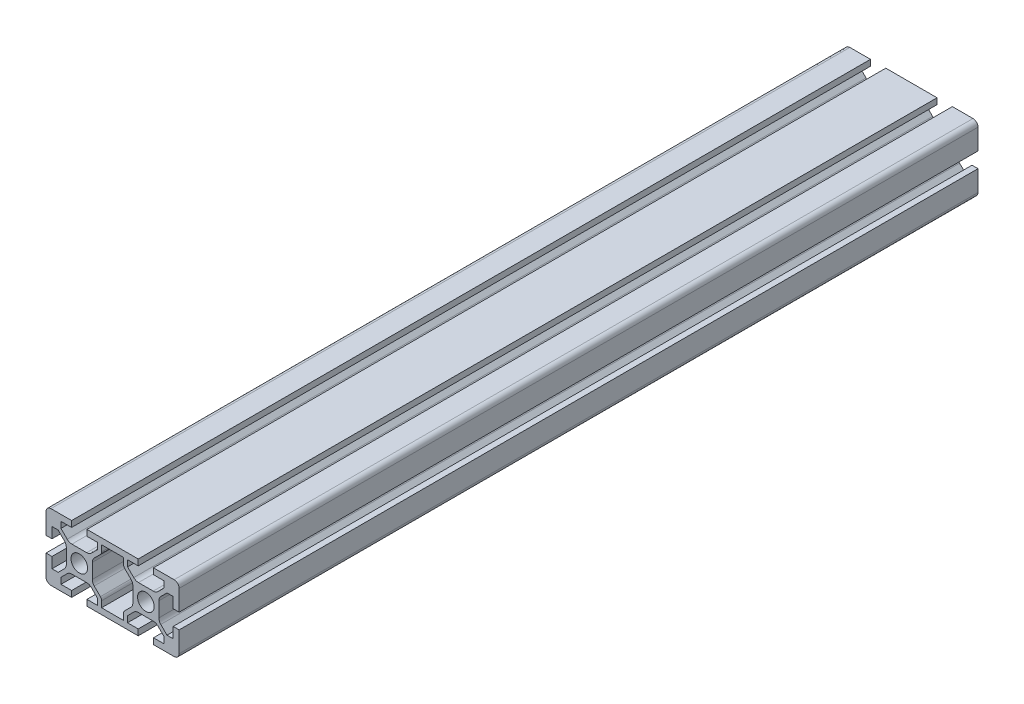
from build123d import *

# Parameters (mm, degrees)
SALIENTE_EXTRUIR1_DEPTH = 240


with BuildPart() as part:
    # Croquis1 → Saliente-Extruir1 (new body)
    with BuildSketch(Plane.XY):
        with BuildLine():
            Line((-10, 8.5), (-10, 2.3))
            Line((-10, 2.3), (-8.2, 2.3))
            Line((-8.2, 2.3), (-8.2, 5.5))
            Line((-8.2, 5.5), (-6.348528137, 5.5))
            Line((-6.348528137, 5.5), (-4.485786438, 3.6372583))
            ThreePointArc((-4.485786438, 3.6372583), (-4.052240935, 2.988411603), (-3.9, 2.223044738))
            Line((-3.9, 2.223044738), (-3.9, 0))
            Line((-3.9, 0), (-3.9, -2.223044738))
            ThreePointArc((-3.9, -2.223044738), (-4.052240935, -2.988411603), (-4.485786438, -3.6372583))
            Line((-4.485786438, -3.6372583), (-6.348528137, -5.5))
            Line((-6.348528137, -5.5), (-8.2, -5.5))
            Line((-8.2, -5.5), (-8.2, -2.3))
            Line((-8.2, -2.3), (-10, -2.3))
            Line((-10, -2.3), (-10, -8.5))
            ThreePointArc((-10, -8.5), (-9.560660172, -9.560660172), (-8.5, -10))
            Line((-8.5, -10), (-2.3, -10))
            Line((-2.3, -10), (-2.3, -8.2))
            Line((-2.3, -8.2), (-5.5, -8.2))
            Line((-5.5, -8.2), (-5.5, -6.348528137))
            Line((-5.5, -6.348528137), (-3.6372583, -4.485786438))
            ThreePointArc((-3.6372583, -4.485786438), (-2.988411603, -4.052240935), (-2.223044738, -3.9))
            Line((-2.223044738, -3.9), (0, -3.9))
            Line((0, -3.9), (2.223044738, -3.9))
            ThreePointArc((2.223044738, -3.9), (2.988411603, -4.052240935), (3.6372583, -4.485786438))
            Line((3.6372583, -4.485786438), (5.5, -6.348528137))
            Line((5.5, -6.348528137), (5.5, -8.2))
            Line((5.5, -8.2), (2.3, -8.2))
            Line((2.3, -8.2), (2.3, -10))
            Line((2.3, -10), (17.7, -10))
            Line((17.7, -10), (17.7, -8.2))
            Line((17.7, -8.2), (14.5, -8.2))
            Line((14.5, -8.2), (14.5, -6.348528137))
            Line((14.5, -6.348528137), (16.3627417, -4.485786438))
            ThreePointArc((16.3627417, -4.485786438), (17.011588397, -4.052240935), (17.776955262, -3.9))
            Line((17.776955262, -3.9), (20, -3.9))
            Line((20, -3.9), (22.223044738, -3.9))
            ThreePointArc((22.223044738, -3.9), (22.988411603, -4.052240935), (23.6372583, -4.485786438))
            Line((23.6372583, -4.485786438), (25.5, -6.348528137))
            Line((25.5, -6.348528137), (25.5, -8.2))
            Line((25.5, -8.2), (22.3, -8.2))
            Line((22.3, -8.2), (22.3, -10))
            Line((22.3, -10), (28.5, -10))
            ThreePointArc((28.5, -10), (29.560660172, -9.560660172), (30, -8.5))
            Line((30, -8.5), (30, -2.3))
            Line((30, -2.3), (28.2, -2.3))
            Line((28.2, -2.3), (28.2, -5.5))
            Line((28.2, -5.5), (26.348528137, -5.5))
            Line((26.348528137, -5.5), (24.485786438, -3.6372583))
            ThreePointArc((24.485786438, -3.6372583), (24.052240935, -2.988411603), (23.9, -2.223044738))
            Line((23.9, -2.223044738), (23.9, 0))
            Line((23.9, 0), (23.9, 2.223044738))
            ThreePointArc((23.9, 2.223044738), (24.052240935, 2.988411603), (24.485786438, 3.6372583))
            Line((24.485786438, 3.6372583), (26.348528137, 5.5))
            Line((26.348528137, 5.5), (28.2, 5.5))
            Line((28.2, 5.5), (28.2, 2.3))
            Line((28.2, 2.3), (30, 2.3))
            Line((30, 2.3), (30, 8.5))
            ThreePointArc((30, 8.5), (29.560660172, 9.560660172), (28.5, 10))
            Line((28.5, 10), (22.3, 10))
            Line((22.3, 10), (22.3, 8.2))
            Line((22.3, 8.2), (25.5, 8.2))
            Line((25.5, 8.2), (25.5, 6.348528137))
            Line((25.5, 6.348528137), (23.6372583, 4.485786438))
            ThreePointArc((23.6372583, 4.485786438), (22.988411603, 4.052240935), (22.223044738, 3.9))
            Line((22.223044738, 3.9), (20, 3.9))
            Line((20, 3.9), (17.776955262, 3.9))
            ThreePointArc((17.776955262, 3.9), (17.011588397, 4.052240935), (16.3627417, 4.485786438))
            Line((16.3627417, 4.485786438), (14.5, 6.348528137))
            Line((14.5, 6.348528137), (14.5, 8.2))
            Line((14.5, 8.2), (17.7, 8.2))
            Line((17.7, 8.2), (17.7, 10))
            Line((17.7, 10), (2.3, 10))
            Line((2.3, 10), (2.3, 8.2))
            Line((2.3, 8.2), (5.5, 8.2))
            Line((5.5, 8.2), (5.5, 6.348528137))
            Line((5.5, 6.348528137), (3.6372583, 4.485786438))
            ThreePointArc((3.6372583, 4.485786438), (2.988411603, 4.052240935), (2.223044738, 3.9))
            Line((2.223044738, 3.9), (0, 3.9))
            Line((0, 3.9), (-2.223044738, 3.9))
            ThreePointArc((-2.223044738, 3.9), (-2.988411603, 4.052240935), (-3.6372583, 4.485786438))
            Line((-3.6372583, 4.485786438), (-5.5, 6.348528137))
            Line((-5.5, 6.348528137), (-5.5, 8.2))
            Line((-5.5, 8.2), (-2.3, 8.2))
            Line((-2.3, 8.2), (-2.3, 10))
            Line((-2.3, 10), (-8.5, 10))
            ThreePointArc((-8.5, 10), (-9.560660172, 9.560660172), (-10, 8.5))
        make_face()
        with BuildLine():
            Line((3.9, 2.223044738), (3.9, 0))
            Line((3.9, 0), (3.9, -2.223044738))
            ThreePointArc((3.9, -2.223044738), (4.052240935, -2.988411603), (4.485786438, -3.6372583))
            Line((4.485786438, -3.6372583), (6.333883476, -5.485355339))
            ThreePointArc((6.333883476, -5.485355339), (6.604849416, -5.890884525), (6.7, -6.369238816))
            Line((6.7, -6.369238816), (6.7, -8.2))
            Line((6.7, -8.2), (13.3, -8.2))
            Line((13.3, -8.2), (13.3, -6.369238816))
            ThreePointArc((13.3, -6.369238816), (13.395150584, -5.890884525), (13.666116524, -5.485355339))
            Line((13.666116524, -5.485355339), (15.514213562, -3.6372583))
            ThreePointArc((15.514213562, -3.6372583), (15.947759065, -2.988411603), (16.1, -2.223044738))
            Line((16.1, -2.223044738), (16.1, 0))
            Line((16.1, 0), (16.1, 2.223044738))
            ThreePointArc((16.1, 2.223044738), (15.947759065, 2.988411603), (15.514213562, 3.6372583))
            Line((15.514213562, 3.6372583), (13.666116524, 5.485355339))
            ThreePointArc((13.666116524, 5.485355339), (13.395150584, 5.890884525), (13.3, 6.369238816))
            Line((13.3, 6.369238816), (13.3, 8.2))
            Line((13.3, 8.2), (6.7, 8.2))
            Line((6.7, 8.2), (6.7, 6.369238816))
            ThreePointArc((6.7, 6.369238816), (6.604849416, 5.890884525), (6.333883476, 5.485355339))
            Line((6.333883476, 5.485355339), (4.485786438, 3.6372583))
            ThreePointArc((4.485786438, 3.6372583), (4.052240935, 2.988411603), (3.9, 2.223044738))
        make_face(mode=Mode.SUBTRACT)
        with BuildLine():
            ThreePointArc((0, 2.5), (-1.767766953, 1.767766953), (-2.5, 0))
            ThreePointArc((-2.5, 0), (-1.767766953, -1.767766953), (0, -2.5))
            ThreePointArc((0, -2.5), (1.767766953, -1.767766953), (2.5, 0))
            ThreePointArc((2.5, 0), (1.767766953, 1.767766953), (0, 2.5))
        make_face(mode=Mode.SUBTRACT)
        with BuildLine():
            ThreePointArc((20, 2.5), (18.232233047, 1.767766953), (17.5, 0))
            ThreePointArc((17.5, 0), (18.232233047, -1.767766953), (20, -2.5))
            ThreePointArc((20, -2.5), (21.767766953, -1.767766953), (22.5, 0))
            ThreePointArc((22.5, 0), (21.767766953, 1.767766953), (20, 2.5))
        make_face(mode=Mode.SUBTRACT)
    extrude(amount=SALIENTE_EXTRUIR1_DEPTH)


solid = part.part
